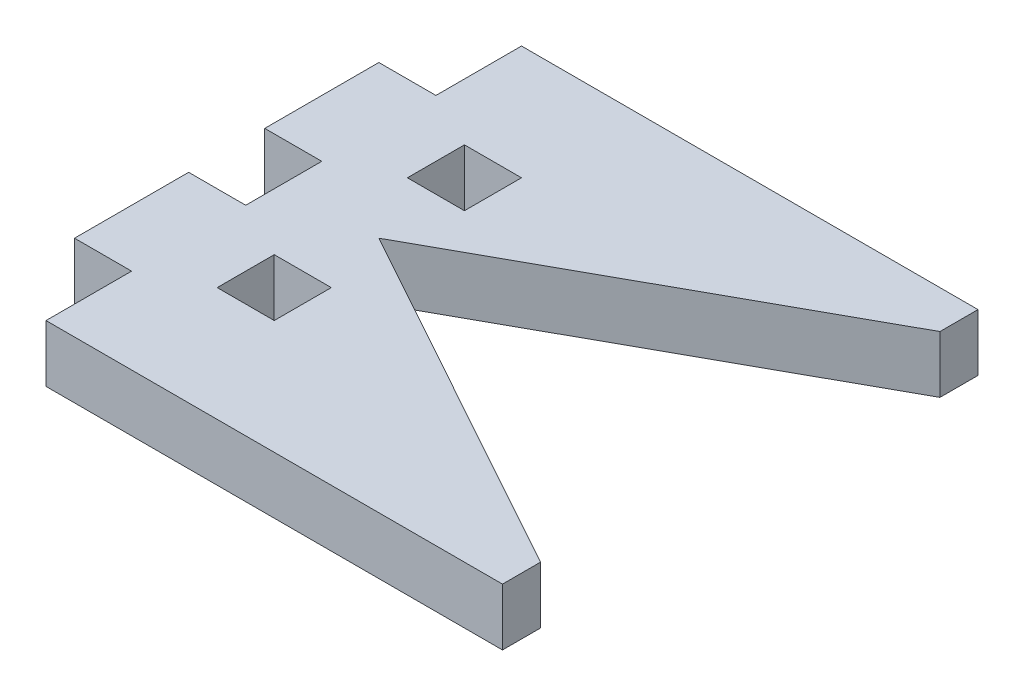
from build123d import *

# Parameters (mm, degrees)
BOSS_EXTRUDE1_DEPTH = 3
SKETCH2_W           = 3
SKETCH2_H           = 3
CUT_EXTRUDE1_DEPTH  = 3


with BuildPart() as part:
    # Sketch1 → Boss-Extrude1 (new body)
    with BuildSketch(Plane(origin=(0, 0, 0), x_dir=(1, 0, 0), z_dir=(0, 1, 0))):
        Polygon((-5.5, 0), (13.5, 10.5), (13.5, 12.5), (-10.5, 12.5), (-10.5, 8), (-13.5, 8), (-13.5, 2), (-10.5, 2), (-10.5, -2), (-13.5, -2), (-13.5, -8), (-10.5, -8), (-10.5, -12.5), (13.5, -12.5), (13.5, -10.5), align=None)
    extrude(amount=BOSS_EXTRUDE1_DEPTH)

    # Sketch2 → Cut-Extrude1 (cut)
    with BuildSketch(Plane(origin=(0, 3, 0), x_dir=(1, 0, 0), z_dir=(0, 1, 0))):
        with Locations((-6, 5)):
            Rectangle(SKETCH2_W, SKETCH2_H)
        with Locations((-6, -5)):
            Rectangle(SKETCH2_W, SKETCH2_H)
    extrude(amount=-CUT_EXTRUDE1_DEPTH, mode=Mode.SUBTRACT)


solid = part.part
